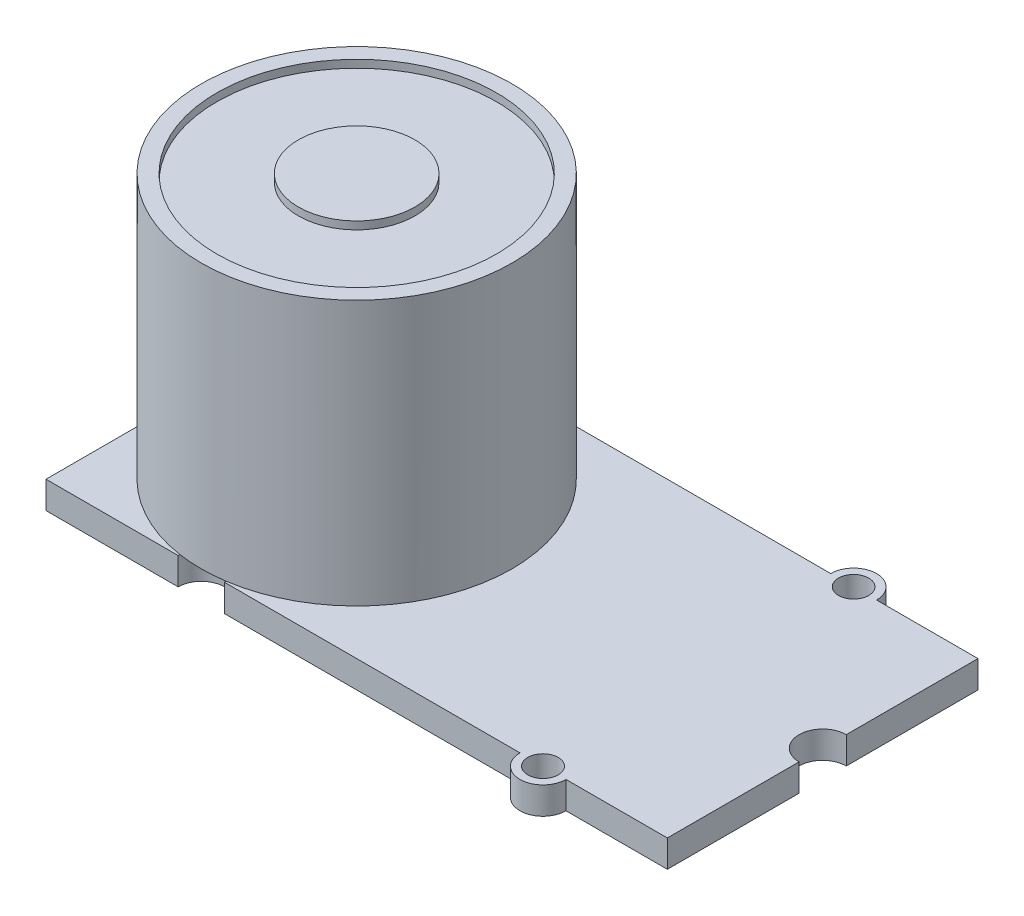
from build123d import *

# Parameters (mm, degrees)
SKETCH1_W           = 40
SKETCH1_H           = 20
BOSS_EXTRUDE1_DEPTH = 1.75
SKETCH2_R           = 10
BOSS_EXTRUDE2_DEPTH = 18.8
SKETCH3_R           = 8.998930974
SKETCH3_R_2         = 3.75
CUT_EXTRUDE2_DEPTH  = 0.5
SKETCH4_R           = 1.519525434
CUT_EXTRUDE3_DEPTH  = 29.119432782
SKETCH5_R           = 1.494488577
SKETCH5_R_2         = 1.544110057
CUT_EXTRUDE5_DEPTH  = 1.75
SKETCH7_R           = 1.482162374
SKETCH7_R_2         = 1.476093664
BOSS_EXTRUDE3_DEPTH = 1.75
SKETCH8_R           = 0.972887348
SKETCH8_R_2         = 0.978406894
CUT_EXTRUDE6_DEPTH  = 29.680002664


with BuildPart() as part:
    # Sketch1 → Boss-Extrude1 (new body)
    with BuildSketch(Plane(origin=(0, 0, 0), x_dir=(1, 0, 0), z_dir=(0, 1, 0))):
        Rectangle(SKETCH1_W, SKETCH1_H)
    extrude(amount=BOSS_EXTRUDE1_DEPTH)

    # Sketch2 → Boss-Extrude2 (add)
    with BuildSketch(Plane(origin=(0, 0, 0), x_dir=(1, 0, 0), z_dir=(0, 1, 0))):
        with Locations(Location((-10, 0, 0), (0, 0, 270))):
            Circle(SKETCH2_R)
    extrude(amount=BOSS_EXTRUDE2_DEPTH)

    # Sketch3 → Cut-Extrude2 (cut)
    with BuildSketch(Plane(origin=(0, 18.8, 0), x_dir=(1, 0, 0), z_dir=(0, 1, 0))):
        with Locations(Location((-10, 0, 0), (0, 0, 270))):
            Circle(SKETCH3_R)
        with Locations(Location((-10, 0, 0), (0, 0, 270))):
            Circle(SKETCH3_R_2, mode=Mode.SUBTRACT)
    extrude(amount=-CUT_EXTRUDE2_DEPTH, mode=Mode.SUBTRACT)

    # Sketch4 → Cut-Extrude3 (cut, through all)
    with BuildSketch(Plane(origin=(0, 1.75, 0), x_dir=(1, 0, 0), z_dir=(0, 1, 0))):
        with Locations((20, 0)):
            Circle(SKETCH4_R)
    extrude(amount=-CUT_EXTRUDE3_DEPTH, mode=Mode.SUBTRACT)

    # Sketch5 → Cut-Extrude5 (cut)
    with BuildSketch(Plane.XZ):
        with Locations((-10, 10)):
            Circle(SKETCH5_R)
        with Locations((-10, -10)):
            Circle(SKETCH5_R_2)
    extrude(amount=-CUT_EXTRUDE5_DEPTH, mode=Mode.SUBTRACT)

    # Sketch7 → Boss-Extrude3 (add)
    with BuildSketch(Plane(origin=(0, 1.75, 0), x_dir=(1, 0, 0), z_dir=(0, 1, 0))):
        with Locations((11.99395038, -10)):
            Circle(SKETCH7_R)
        with Locations((11.99395038, 10)):
            Circle(SKETCH7_R_2)
    extrude(amount=-BOSS_EXTRUDE3_DEPTH)

    # Sketch8 → Cut-Extrude6 (cut, through all)
    with BuildSketch(Plane(origin=(0, 1.75, 0), x_dir=(1, 0, 0), z_dir=(0, 1, 0))):
        with Locations(Location((11.99395038, 10, 0), (0, 0, 270))):
            Circle(SKETCH8_R)
        with Locations(Location((11.99395038, -10, 0), (0, 0, 270))):
            Circle(SKETCH8_R_2)
    extrude(amount=-CUT_EXTRUDE6_DEPTH, mode=Mode.SUBTRACT)


solid = part.part
